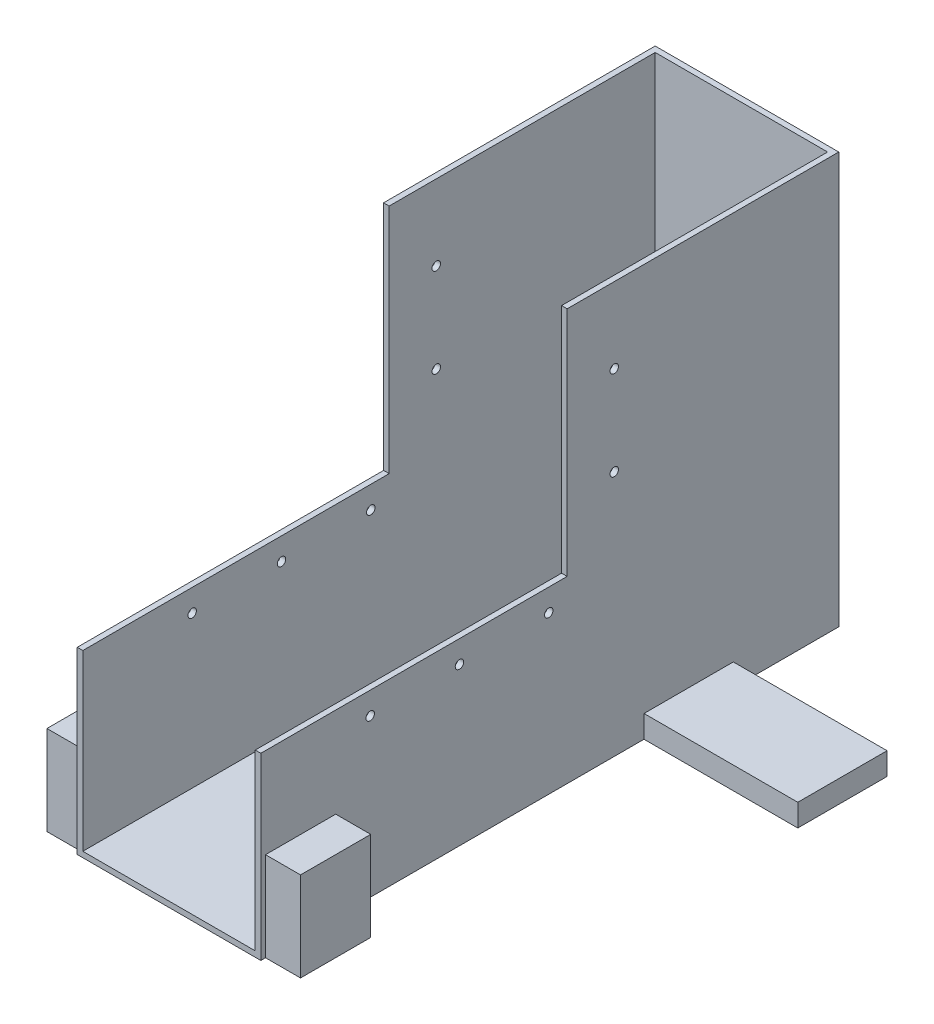
from build123d import *

# Parameters (mm, degrees)
BOSS_EXTRUDE1_DEPTH = 6.35
SKETCH17_W          = 196.1896
SKETCH17_H          = 657.6157706
BOSS_EXTRUDE2_DEPTH = 6.35
SKETCH18_W          = 208.8896
SKETCH18_H          = 467.912654328
BOSS_EXTRUDE3_DEPTH = 6.35
SKETCH20_W          = 174.9552
SKETCH20_H          = 101.6
BOSS_EXTRUDE4_DEPTH = 25.4
SKETCH22_W          = 39.8272
SKETCH22_H          = 79.88897833
BOSS_EXTRUDE5_DEPTH = 101.6
SKETCH25_R          = 4.826
CUT_EXTRUDE1_DEPTH  = 6.35


with BuildPart() as part:
    # Sketch15 → Boss-Extrude1 (new body)
    with BuildSketch(Plane(origin=(0, 0, 0), x_dir=(0, 0, -1), z_dir=(1, 0, 0))):
        Polygon((0, 0), (-657.6157706, 0), (-657.6157706, 204.204861602), (-309.033798252, 204.204861602), (-309.033798252, 467.912654328), (0, 467.912654328), align=None)
    boss_extrude1 = extrude(amount=-BOSS_EXTRUDE1_DEPTH)

    # Sketch17 → Boss-Extrude2 (add)
    with BuildSketch(Plane(origin=(0, 0, 0), x_dir=(1, 0, 0), z_dir=(0, 1, 0))):
        with Locations((98.0948, -328.8078853)):
            Rectangle(SKETCH17_W, SKETCH17_H)
    extrude(amount=BOSS_EXTRUDE2_DEPTH)

    # Mirror1: Boss-Extrude1 across plane
    add(boss_extrude1.mirror(Plane(origin=(98.0948, 0, 0), x_dir=(0, 0, 1), z_dir=(1, 0, 0))))

    # Sketch18 → Boss-Extrude3 (add)
    with BuildSketch(Plane(origin=(0, 0, 0), x_dir=(-1, 0, 0), z_dir=(0, 0, -1))):
        with Locations((-98.0948, 233.956327164)):
            Rectangle(SKETCH18_W, SKETCH18_H)
    extrude(amount=-BOSS_EXTRUDE3_DEPTH)

    # Sketch20 → Boss-Extrude4 (add)
    with BuildSketch(Plane(origin=(0, 0, 0), x_dir=(1, 0, 0), z_dir=(0, 1, 0))):
        with Locations((-93.8276, -170.785936787)):
            Rectangle(SKETCH20_W, SKETCH20_H)
        with Locations((290.0172, -170.785936787)):
            Rectangle(SKETCH20_W, SKETCH20_H)
    extrude(amount=BOSS_EXTRUDE4_DEPTH)

    # Sketch22 → Boss-Extrude5 (add)
    with BuildSketch(Plane(origin=(0, 0, 0), x_dir=(1, 0, 0), z_dir=(0, 1, 0))):
        with Locations((-26.2636, -612.31684817)):
            Rectangle(SKETCH22_W, SKETCH22_H)
        with Locations((222.4532, -612.31684817)):
            Rectangle(SKETCH22_W, SKETCH22_H)
    extrude(amount=BOSS_EXTRUDE5_DEPTH)

    # Sketch25 → Cut-Extrude1 (cut)
    with BuildSketch(Plane.ZY.offset(6.35)):
        with Locations((533.1557706, 178.804861602)):
            Circle(SKETCH25_R)
        with Locations((431.5557706, 178.804861602)):
            Circle(SKETCH25_R)
        with Locations((329.9557706, 178.804861602)):
            Circle(SKETCH25_R)
        with Locations((255.439798252, 280.460654328)):
            Circle(SKETCH25_R)
        with Locations((255.439798252, 382.060654328)):
            Circle(SKETCH25_R)
    cut_extrude1 = extrude(amount=-CUT_EXTRUDE1_DEPTH, mode=Mode.SUBTRACT)

    # Mirror2: Cut-Extrude1 across plane
    add(cut_extrude1.mirror(Plane(origin=(98.0948, 0, 0), x_dir=(0, 0, 1), z_dir=(1, 0, 0))), mode=Mode.SUBTRACT)


solid = part.part
